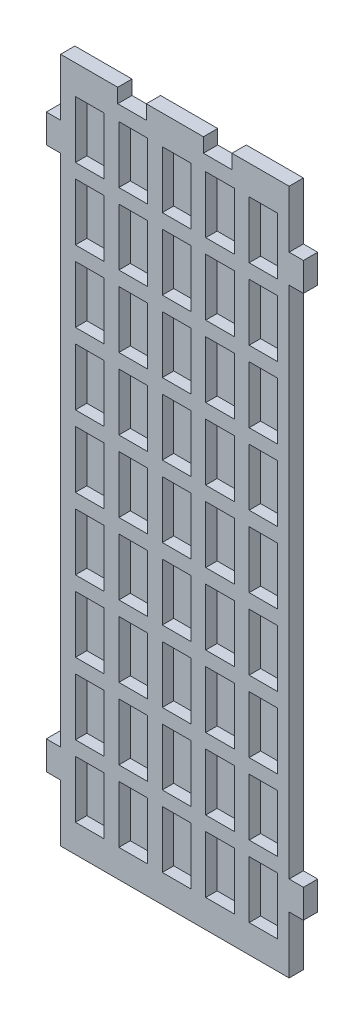
from build123d import *

# Parameters (mm, degrees)
BOSS_EXTRUDE1_DEPTH  = 3.175
SKETCH2_W            = 6.35
SKETCH2_H            = 12.7
CUT_EXTRUDE1_DEPTH   = 2.54
LPATTERN1_COUNT      = 5
LPATTERN1_PITCH      = 9.652
LPATTERN1_COUNT_DIR2 = 9
LPATTERN1_PITCH_DIR2 = 15.875


with BuildPart() as part:
    # Sketch1 → Boss-Extrude1 (new body)
    with BuildSketch(Plane.XY):
        Polygon((31.75, 0), (19.05, 0), (19.05, -3.175), (12.7, -3.175), (12.7, 0), (0, 0), (0, -12.7), (-3.175, -12.7), (-3.175, -19.05), (0, -19.05), (0, -133.35), (-3.175, -133.35), (-3.175, -139.7), (0, -139.7), (0, -152.4), (12.7, -152.4), (38.1, -152.4), (50.8, -152.4), (50.8, -139.7), (53.975, -139.7), (53.975, -133.35), (50.8, -133.35), (50.8, -19.05), (53.975, -19.05), (53.975, -12.7), (50.8, -12.7), (50.8, 0), (38.1, 0), (38.1, -3.175), (31.75, -3.175), align=None)
    extrude(amount=BOSS_EXTRUDE1_DEPTH)

    # Sketch2 → Cut-Extrude1 (cut)
    with BuildSketch(Plane.XY.offset(3.175)):
        with Locations((6.477, -12.827)):
            Rectangle(SKETCH2_W, SKETCH2_H)
    cut_extrude1 = extrude(amount=-CUT_EXTRUDE1_DEPTH, mode=Mode.SUBTRACT)

    # LPattern1: Cut-Extrude1 5 × 9
    with Locations(*[(i * LPATTERN1_PITCH, -j * LPATTERN1_PITCH_DIR2, 0) for i in range(LPATTERN1_COUNT) for j in range(LPATTERN1_COUNT_DIR2) if (i, j) != (0, 0)]):
        add(cut_extrude1, mode=Mode.SUBTRACT)


solid = part.part
